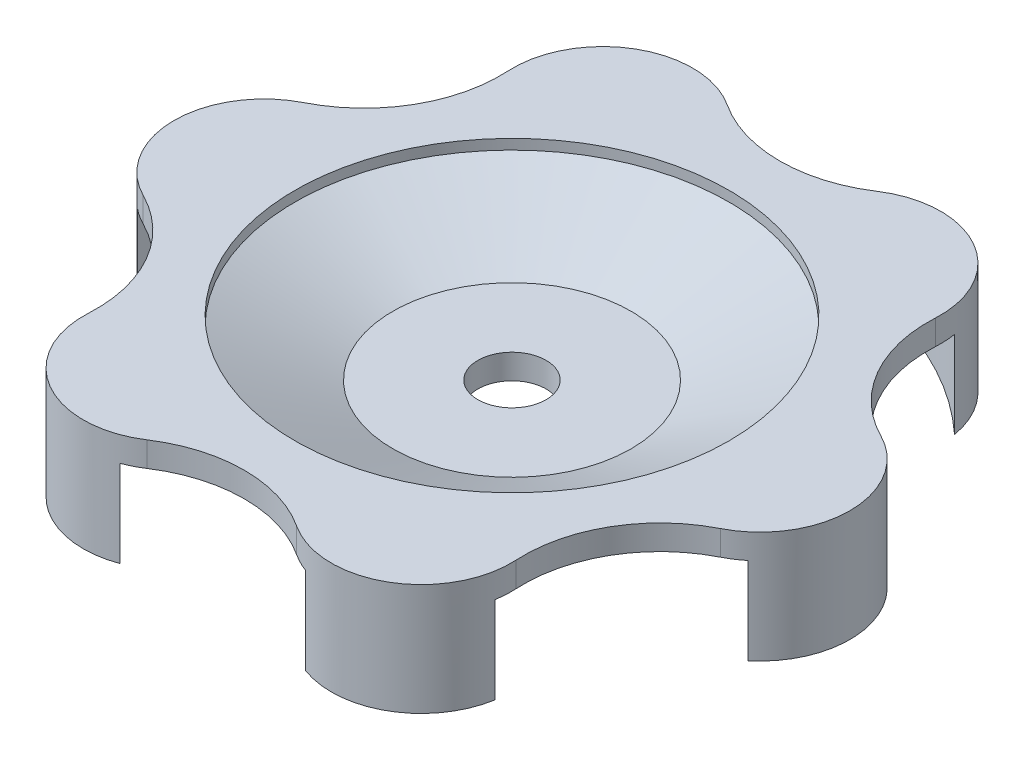
from build123d import *

# Parameters (mm, degrees)
SKETCH_7_OUTSIDE_W  = 72.02
SKETCH_7_OUTSIDE_H  = 72.02
CUT_EXTRUDE_3_DEPTH = 11


with BuildPart() as part:
    # 草图4 → 旋转-薄壁1 (revolve)
    with BuildSketch(Plane.XY):
        Polygon((2.75, 4.5), (9.608214533, 4.5), (17.5, 8.18), (17.5, 9), (27.25, 9), (27.25, 0), (25.25, 0), (25.25, 7), (19.5, 7), (19.5, 6.905859478), (10.051603858, 2.5), (2.75, 2.5), align=None)
    revolve(axis=Axis((0, 0, 0), (0, 1, 0)))

    # 草图7 outside → 切除-拉伸3 (cut)
    with BuildSketch(Plane(origin=(0, 0, 0), x_dir=(1, 0, 0), z_dir=(0, 1, 0))):
        Rectangle(SKETCH_7_OUTSIDE_W, SKETCH_7_OUTSIDE_H)
        with BuildLine():
            ThreePointArc((23.265907271, -6.472738964), (27.25, 0), (23.265907271, 6.472738964))
            ThreePointArc((23.265907271, 6.472738964), (18.694797481, 10.793446358), (17.23851001, 16.912497256))
            ThreePointArc((17.23851001, 16.912497256), (13.625, 23.599192253), (6.02739726, 23.385236221))
            ThreePointArc((6.02739726, 23.385236221), (0, 21.586892716), (-6.02739726, 23.385236221))
            ThreePointArc((-6.02739726, 23.385236221), (-13.625, 23.599192253), (-17.23851001, 16.912497256))
            ThreePointArc((-17.23851001, 16.912497256), (-18.694797481, 10.793446358), (-23.265907271, 6.472738964))
            ThreePointArc((-23.265907271, 6.472738964), (-27.25, 0), (-23.265907271, -6.472738964))
            ThreePointArc((-23.265907271, -6.472738964), (-18.694797481, -10.793446358), (-17.23851001, -16.912497256))
            ThreePointArc((-17.23851001, -16.912497256), (-13.625, -23.599192253), (-6.02739726, -23.385236221))
            ThreePointArc((-6.02739726, -23.385236221), (0, -21.586892716), (6.02739726, -23.385236221))
            ThreePointArc((6.02739726, -23.385236221), (13.625, -23.599192253), (17.23851001, -16.912497256))
            ThreePointArc((17.23851001, -16.912497256), (18.694797481, -10.793446358), (23.265907271, -6.472738964))
        make_face(mode=Mode.SUBTRACT)
    extrude(amount=CUT_EXTRUDE_3_DEPTH, mode=Mode.SUBTRACT)


solid = part.part
